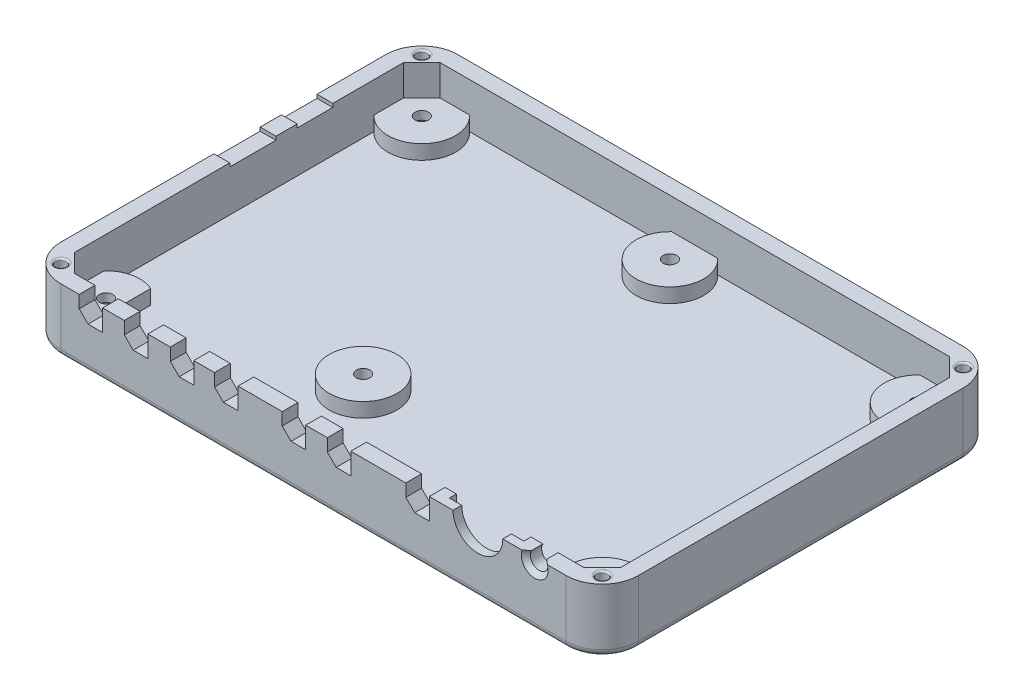
from build123d import *

# Parameters (mm, degrees)
BOSS_EXTRUDE1_DEPTH     = 40
SKETCH2_R               = 2.5
SKETCH2_W               = 6.604
SKETCH2_H               = 16
CUT_EXTRUDE1_DEPTH      = 40
SKETCH3_W               = 10
SKETCH3_H               = 12
SKETCH3_W_2             = 13
CUT_EXTRUDE2_DEPTH      = 40
CUT_EXTRUDE3_DEPTH      = 120
FILLET1_R               = 2
CUT_EXTRUDE4_DEPTH      = 12.7
SKETCH6_R               = 9.525
BOSS_EXTRUDE2_DEPTH     = 4.064
SKETCH7_W               = 11.676427735
SKETCH7_H               = 23.200256036
CUT_EXTRUDE5_DEPTH      = 4.064
SKETCH8_R               = 1.905
CUT_EXTRUDE6_DEPTH      = 14.224
SKETCH9_R               = 3.25
CUT_EXTRUDE7_DEPTH      = 7
CHAMFER1_SIZE           = 1.27
SKETCH11_R              = 1.524
CUT_EXTRUDE8_DEPTH      = 3
MIRROR2_COPY_1_SKETCH_R = 1.524
MIRROR2_COPY_1_DEPTH    = 3
FILLET2_R               = 0.508
CHAMFER2_SIZE           = 2.5
SKETCH13_W              = 21
SKETCH13_H              = 21
CUT_EXTRUDE10_DEPTH     = 2
CUT_EXTRUDE11_DEPTH     = 2.54


with BuildPart() as part:
    # Sketch1 → Boss-Extrude1 (new body)
    with BuildSketch(Plane(origin=(0, 0, 0), x_dir=(1, 0, 0), z_dir=(0, 1, 0))):
        with BuildLine():
            Line((-71.12, 55.88), (71.12, 55.88))
            ThreePointArc((71.12, 55.88), (78.304204897, 52.904204897), (81.28, 45.72))
            Line((81.28, 45.72), (81.28, -45.72))
            ThreePointArc((81.28, -45.72), (78.304204897, -52.904204897), (71.12, -55.88))
            Line((71.12, -55.88), (-71.12, -55.88))
            ThreePointArc((-71.12, -55.88), (-78.304204897, -52.904204897), (-81.28, -45.72))
            Line((-81.28, -45.72), (-81.28, 45.72))
            ThreePointArc((-81.28, 45.72), (-78.304204897, 52.904204897), (-71.12, 55.88))
        make_face()
    extrude(amount=BOSS_EXTRUDE1_DEPTH)

    # Sketch2 → Cut-Extrude1 (cut)
    with BuildSketch(Plane.XY.offset(55.88)):
        with Locations((62.28, 16.68)):
            Circle(SKETCH2_R)
        with BuildLine():
            Line((42.620513585, 23.965662), (49.944686415, 23.965662))
            ThreePointArc((49.944686415, 23.965662), (46.2826, 11), (42.620513585, 23.965662))
        make_face()
        with Locations((-62.658, 20)):
            Rectangle(SKETCH2_W, SKETCH2_H)
        with Locations((-49.958, 20)):
            Rectangle(SKETCH2_W, SKETCH2_H)
        with Locations((-37.004, 20)):
            Rectangle(SKETCH2_W, SKETCH2_H)
        with Locations((-24.558, 20)):
            Rectangle(SKETCH2_W, SKETCH2_H)
        with Locations((-5.508, 20)):
            Rectangle(SKETCH2_W, SKETCH2_H)
        with Locations((7.192, 20)):
            Rectangle(SKETCH2_W, SKETCH2_H)
        with Locations((29.29, 20)):
            Rectangle(SKETCH2_W, SKETCH2_H)
    extrude(amount=-CUT_EXTRUDE1_DEPTH, mode=Mode.SUBTRACT)

    # Sketch3 → Cut-Extrude2 (cut)
    with BuildSketch(Plane.ZY.offset(81.28)):
        with Locations((-21.38, 23)):
            Rectangle(SKETCH3_W, SKETCH3_H)
        with Locations((-3.88, 23)):
            Rectangle(SKETCH3_W_2, SKETCH3_H)
    extrude(amount=-CUT_EXTRUDE2_DEPTH, mode=Mode.SUBTRACT)

    # Sketch4 → Cut-Extrude3 (cut)
    with BuildSketch(Plane.XY.offset(55.88)):
        Polygon((46.2826, 18), (-91.284131273, 18), (-91.284131273, 53.822407205), (88.19283599, 53.822407205), (88.19283599, 18), align=None)
    extrude(amount=-CUT_EXTRUDE3_DEPTH, mode=Mode.SUBTRACT)

    # Fillet1
    fillet1_edges = [part.edges().sort_by_distance(p)[0] for p in [
        (0, 0, 55.88),
        (-78.304204897, 0, 52.904204897),
        (-81.28, 0, 0),
        (-78.304204897, 0, -52.904204897),
        (0, 0, -55.88),
        (78.304204897, 0, -52.904204897),
        (81.28, 0, 0),
        (78.304204897, 0, 52.904204897),
    ]]
    fillet(fillet1_edges, radius=FILLET1_R)

    # Sketch5 → Cut-Extrude4 (cut)
    with BuildSketch(Plane(origin=(0, 18, 0), x_dir=(1, 0, 0), z_dir=(0, 1, 0))):
        Polygon((-76.835, -46.355), (-71.755, -51.435), (71.755, -51.435), (76.835, -46.355), (76.835, 46.355), (71.755, 51.435), (-71.755, 51.435), (-76.835, 46.355), align=None)
    extrude(amount=-CUT_EXTRUDE4_DEPTH, mode=Mode.SUBTRACT)

    # Sketch6 → Boss-Extrude2 (add)
    with BuildSketch(Plane(origin=(0, 5.3, 0), x_dir=(1, 0, 0), z_dir=(0, 1, 0))):
        with Locations((-69.85, -44.45)):
            Circle(SKETCH6_R)
        with Locations((-69.85, 44.45)):
            Circle(SKETCH6_R)
        with Locations((0, 44.45)):
            Circle(SKETCH6_R)
        with Locations((69.85, 44.45)):
            Circle(SKETCH6_R)
        with Locations(Location((-15.24, -26.67, 0), (0, 0, 270))):
            Circle(SKETCH6_R)
        with Locations((69.85, -44.45)):
            Circle(SKETCH6_R)
    extrude(amount=BOSS_EXTRUDE2_DEPTH)

    # Sketch7 → Cut-Extrude5 (cut)
    with BuildSketch(Plane(origin=(0, 9.364, 0), x_dir=(1, 0, 0), z_dir=(0, 1, 0))):
        with Locations((-60.121786133, -39.834871982)):
            Rectangle(SKETCH7_W, SKETCH7_H)
    extrude(amount=-CUT_EXTRUDE5_DEPTH, mode=Mode.SUBTRACT)

    # Sketch8 → Cut-Extrude6 (cut)
    with BuildSketch(Plane(origin=(0, 9.364, 0), x_dir=(1, 0, 0), z_dir=(0, 1, 0))):
        with Locations(Location((-69.85, 44.45, 0), (0, 0, 270))):
            Circle(SKETCH8_R)
        with Locations(Location((0, 44.45, 0), (0, 0, 270))):
            Circle(SKETCH8_R)
        with Locations(Location((69.85, 44.45, 0), (0, 0, 270))):
            Circle(SKETCH8_R)
        with Locations(Location((69.85, -44.45, 0), (0, 0, 270))):
            Circle(SKETCH8_R)
        with Locations(Location((-15.24, -26.67, 0), (0, 0, 270))):
            Circle(SKETCH8_R)
        with Locations(Location((-69.85, -44.45, 0), (0, 0, 270))):
            Circle(SKETCH8_R)
    extrude(amount=-CUT_EXTRUDE6_DEPTH, mode=Mode.SUBTRACT)

    # Sketch9 → Cut-Extrude7 (cut)
    with BuildSketch(Plane.XZ):
        with Locations(Location((-69.85, 44.45, 0), (0, 0, 270))):
            Circle(SKETCH9_R)
        with Locations(Location((69.85, 44.45, 0), (0, 0, 270))):
            Circle(SKETCH9_R)
        with Locations(Location((69.85, -44.45, 0), (0, 0, 270))):
            Circle(SKETCH9_R)
        with Locations(Location((-69.85, -44.45, 0), (0, 0, 270))):
            Circle(SKETCH9_R)
    extrude(amount=-CUT_EXTRUDE7_DEPTH, mode=Mode.SUBTRACT)

    # Chamfer1
    chamfer1_edges = [part.edges().sort_by_distance(p)[0] for p in [
        (62.28, 14.18, 55.88),
    ]]
    chamfer(chamfer1_edges, length=CHAMFER1_SIZE)

    # Sketch11 → Cut-Extrude8 (cut)
    with BuildSketch(Plane(origin=(0, 18, 0), x_dir=(1, 0, 0), z_dir=(0, 1, 0))):
        with Locations(Location((-76.2, 50.8, 0), (0, 0, 270))):
            Circle(SKETCH11_R)
    cut_extrude8 = extrude(amount=-CUT_EXTRUDE8_DEPTH, mode=Mode.SUBTRACT)

    # Mirror1: Cut-Extrude8 across plane
    add(cut_extrude8.mirror(Plane.XY), mode=Mode.SUBTRACT)

    # Mirror2: Cut-Extrude8 across plane
    add(cut_extrude8.mirror(Plane(origin=(0, 0, 0), x_dir=(0, 0, 1), z_dir=(1, 0, 0))), mode=Mode.SUBTRACT)

    # Mirror2 copy 1 sketch → Mirror2 copy 1 (cut)
    with BuildSketch(Plane(origin=(0, 18, 0), x_dir=(-1, 0, 0), z_dir=(0, 1, 0))):
        with Locations(Location((-76.2, 50.8, 0), (0, 0, 270))):
            Circle(MIRROR2_COPY_1_SKETCH_R)
    extrude(amount=-MIRROR2_COPY_1_DEPTH, mode=Mode.SUBTRACT)

    # Fillet2
    fillet2_edges = [part.edges().sort_by_distance(p)[0] for p in [
        (-76.2, 18, -52.324),
        (-76.2, 18, 52.324),
        (76.2, 18, -52.324),
        (76.2, 18, 52.324),
    ]]
    fillet(fillet2_edges, radius=FILLET2_R)

    # Chamfer2
    chamfer2_edges = [part.edges().sort_by_distance(p)[0] for p in [
        (25.988, 12, 53.6575),
        (3.89, 12, 53.6575),
        (-8.81, 12, 53.6575),
        (-27.86, 12, 53.6575),
        (-40.306, 12, 53.6575),
        (-53.26, 12, 53.6575),
        (-65.96, 12, 53.6575),
    ]]
    chamfer(chamfer2_edges, length=CHAMFER2_SIZE)

    # Sketch13 → Cut-Extrude10 (cut)
    with BuildSketch(Plane(origin=(0, 0, 51.435), x_dir=(-1, 0, 0), z_dir=(0, 0, -1))):
        with Locations((-46.2826, 18)):
            Rectangle(SKETCH13_W, SKETCH13_H)
    extrude(amount=-CUT_EXTRUDE10_DEPTH, mode=Mode.SUBTRACT)

    # Sketch14 → Cut-Extrude11 (cut)
    with BuildSketch(Plane.XZ):
        Polygon((-13.103425912, 23.726354103), (-11.622440829, 27.048504489), (-13.759014917, 29.992150386), (-17.376574088, 29.613645897), (-18.857559171, 26.291495511), (-16.720985083, 23.347849614), align=None)
        Polygon((2.927611814, -46.608492313), (3.333115084, -42.993859954), (0.40550327, -40.83536764), (-2.927611814, -42.291507687), (-3.333115084, -45.906140046), (-0.40550327, -48.06463236), align=None)
    extrude(amount=-CUT_EXTRUDE11_DEPTH, mode=Mode.SUBTRACT)


solid = part.part
